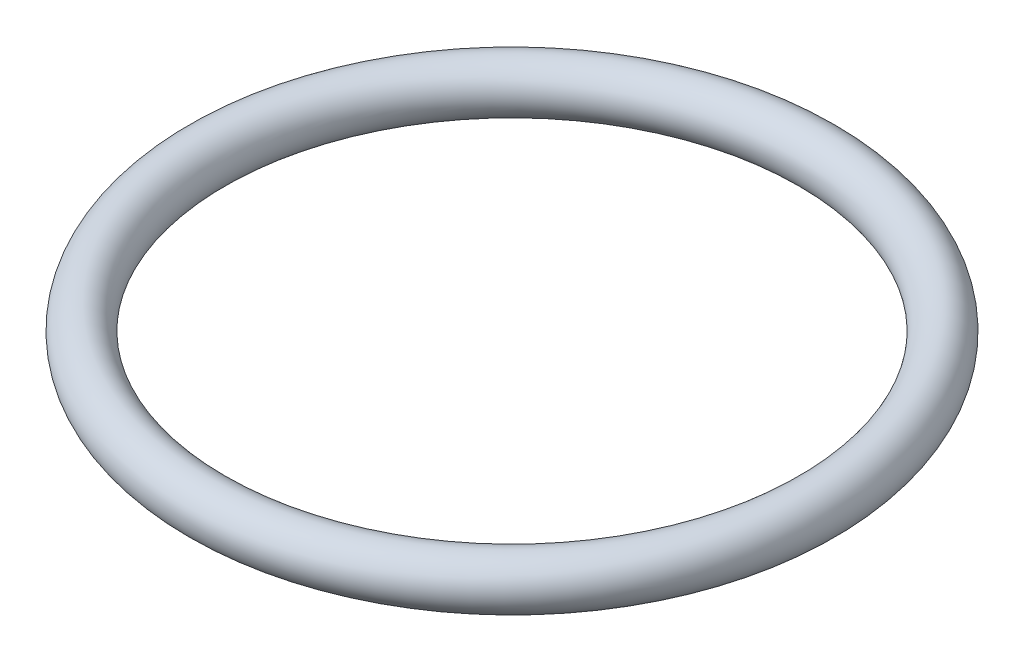
from build123d import *

# Parameters (mm, degrees)
SKETCH3_R = 0.7


with BuildPart() as part:
    # Sketch3 → Revolve1 (revolve)
    with BuildSketch(Plane.XY, mode=Mode.PRIVATE) as revolve1_sk:
        with Locations((8.5, 0)):
            Circle(SKETCH3_R)
    revolve(revolve1_sk.sketch.rotate(Axis((0, 0, 0), (0, 1, 0)), 90), axis=Axis((0, 0, 0), (0, 1, 0)))


solid = part.part
